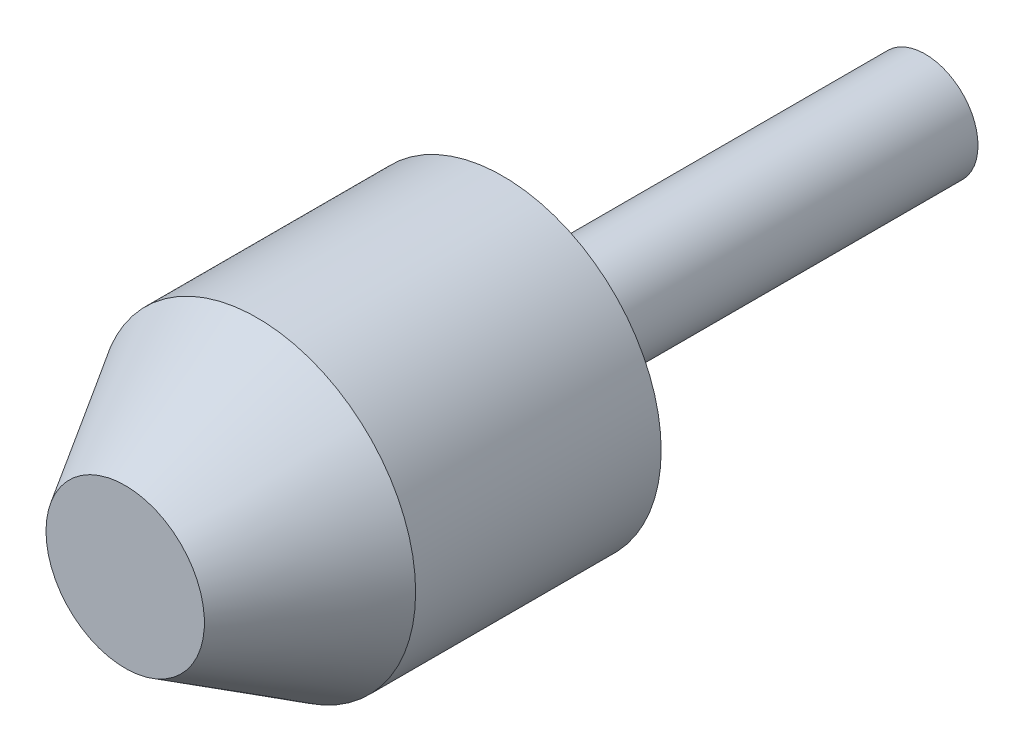
from build123d import *

# Parameters (mm, degrees)
SKETCH_1_R      = 2
EXTRUDE_1_DEPTH = 16
SKETCH_2_R      = 6
EXTRUDE_2_DEPTH = 14.3


with BuildPart() as part:
    # 草图1 → 凸台-拉伸1 (new body)
    with BuildSketch(Plane.XY):
        Circle(SKETCH_1_R)
    extrude(amount=EXTRUDE_1_DEPTH)

    # 草图2 → 凸台-拉伸2 (add)
    with BuildSketch(Plane.XY.offset(16)):
        Circle(SKETCH_2_R)
    extrude(amount=EXTRUDE_2_DEPTH)

    # 草图3 → 切除-旋转2 (revolve, cut)
    with BuildSketch(Plane(origin=(0, 0, 0), x_dir=(1, 0, 0), z_dir=(0, 1, 0))):
        Polygon((-3, -30.3), (-6, -25.3), (-6, -30.3), align=None)
    revolve(axis=Axis((0, 0, 0), (0, 0, 1)), mode=Mode.SUBTRACT)


solid = part.part
